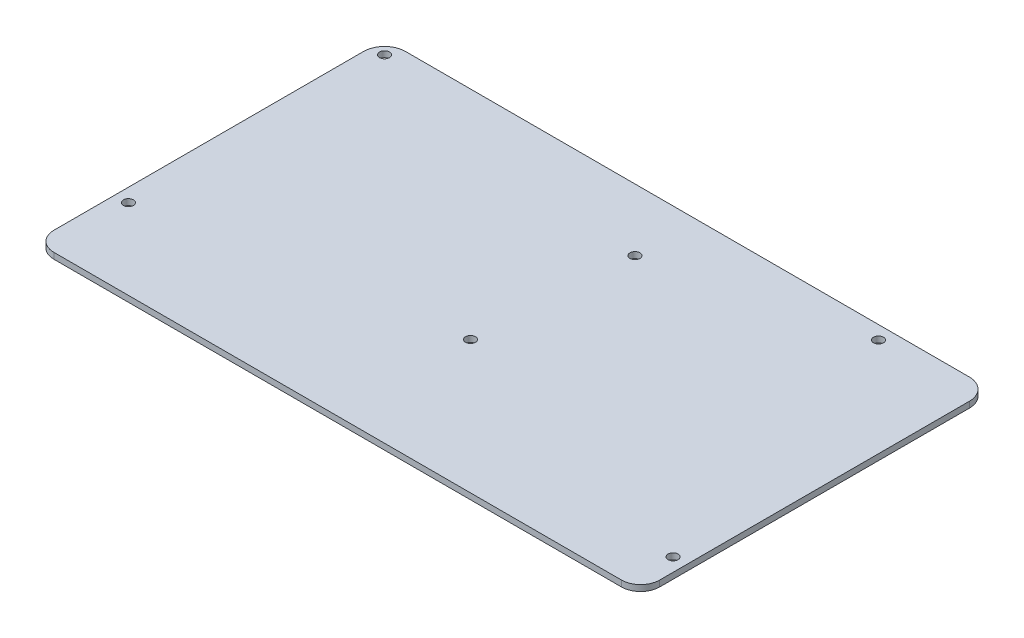
from build123d import *

# Parameters (mm, degrees)
SKETCH1_W           = 201.28
SKETCH1_H           = 116.21
SKETCH1_R           = 1.65
BOSS_EXTRUDE1_DEPTH = 2
FILLET1_R           = 6.98
FILLET2_R           = 6.35


with BuildPart() as part:
    # Sketch1 → Boss-Extrude1 (new body)
    with BuildSketch(Plane(origin=(0, 0, 0), x_dir=(1, 0, 0), z_dir=(0, 1, 0))):
        with Locations((-100.64, 58.105)):
            Rectangle(SKETCH1_W, SKETCH1_H)
        with Locations(Location((-196.83, 26.67, 0), (0, 0, 270))):
            Circle(SKETCH1_R, mode=Mode.SUBTRACT)
        with Locations(Location((-196.83, 111.76, 0), (0, 0, 270))):
            Circle(SKETCH1_R, mode=Mode.SUBTRACT)
        with Locations(Location((-32.71, 111.76, 0), (0, 0, 270))):
            Circle(SKETCH1_R, mode=Mode.SUBTRACT)
        with Locations(Location((-4.45, 15.24, 0), (0, 0, 270))):
            Circle(SKETCH1_R, mode=Mode.SUBTRACT)
        with Locations(Location((-97.45, 95.57, 0), (0, 0, 270))):
            Circle(SKETCH1_R, mode=Mode.SUBTRACT)
        with Locations(Location((-100.63, 44.13, 0), (0, 0, 270))):
            Circle(SKETCH1_R, mode=Mode.SUBTRACT)
    extrude(amount=BOSS_EXTRUDE1_DEPTH)

    # Fillet1
    fillet1_edges = [part.edges().sort_by_distance(p)[0] for p in [
        (-201.28, 1, -116.21),
        (0, 1, -116.21),
    ]]
    fillet(fillet1_edges, radius=FILLET1_R)

    # Fillet2
    fillet2_edges = [part.edges().sort_by_distance(p)[0] for p in [
        (0, 1, 0),
        (-201.28, 1, 0),
    ]]
    fillet(fillet2_edges, radius=FILLET2_R)


solid = part.part
